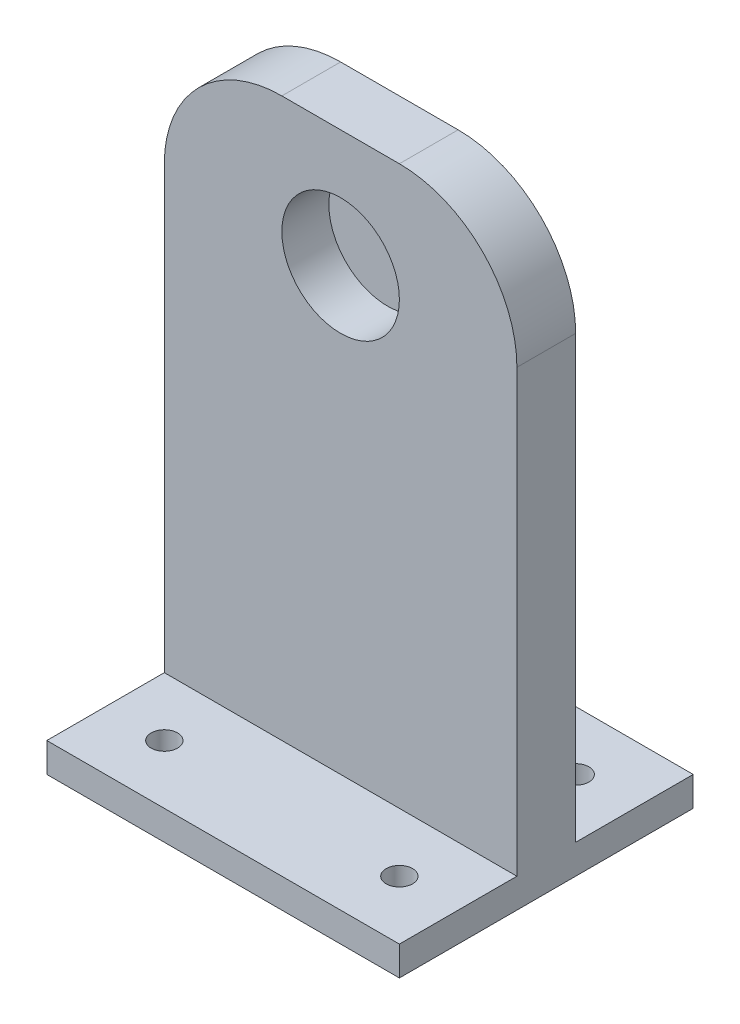
from build123d import *

# Parameters (mm, degrees)
SKETCH_1_W          = 60
SKETCH_1_H          = 100
SKETCH_1_R          = 10
EXTRUDE_1_DEPTH     = 10
SKETCH_2_R          = 10
EXTRUDE_2_DEPTH     = 2
FILLET_1_R          = 20
SKETCH_3_W          = 60
SKETCH_3_H          = 50
EXTRUDE_3_DEPTH     = 5
SKETCH_4_R          = 2.25
CUT_EXTRUDE_1_DEPTH = 105.043260233


with BuildPart() as part:
    # 草图1 → 凸台-拉伸1 (new body)
    with BuildSketch(Plane.XY):
        with Locations((0, 50)):
            Rectangle(SKETCH_1_W, SKETCH_1_H)
        with Locations((0, 80)):
            Circle(SKETCH_1_R, mode=Mode.SUBTRACT)
    extrude(amount=EXTRUDE_1_DEPTH)

    # 草图2 → 凸台-拉伸2 (add)
    with BuildSketch(Plane(origin=(0, 0, 0), x_dir=(-1, 0, 0), z_dir=(0, 0, -1))):
        with Locations((0, 80)):
            Circle(SKETCH_2_R)
    extrude(amount=-EXTRUDE_2_DEPTH)

    # 圆角1
    fillet_1_edges = [part.edges().sort_by_distance(p)[0] for p in [
        (-30, 100, 5),
        (30, 100, 5),
    ]]
    fillet(fillet_1_edges, radius=FILLET_1_R)

    # 草图3 → 凸台-拉伸3 (add)
    with BuildSketch(Plane.XZ):
        with Locations((0, 5)):
            Rectangle(SKETCH_3_W, SKETCH_3_H)
    extrude(amount=-EXTRUDE_3_DEPTH)

    # 草图4 → 切除-拉伸1 (cut, through all)
    with BuildSketch(Plane(origin=(0, 5, 0), x_dir=(1, 0, 0), z_dir=(0, 1, 0))):
        with Locations(Location((-20, 10, 0), (0, 0, 270))):
            Circle(SKETCH_4_R)
        with Locations(Location((20, 10, 0), (0, 0, 270))):
            Circle(SKETCH_4_R)
        with Locations(Location((-20, -20, 0), (0, 0, 270))):
            Circle(SKETCH_4_R)
        with Locations(Location((20, -20, 0), (0, 0, 270))):
            Circle(SKETCH_4_R)
    extrude(amount=-CUT_EXTRUDE_1_DEPTH, mode=Mode.SUBTRACT)


solid = part.part
